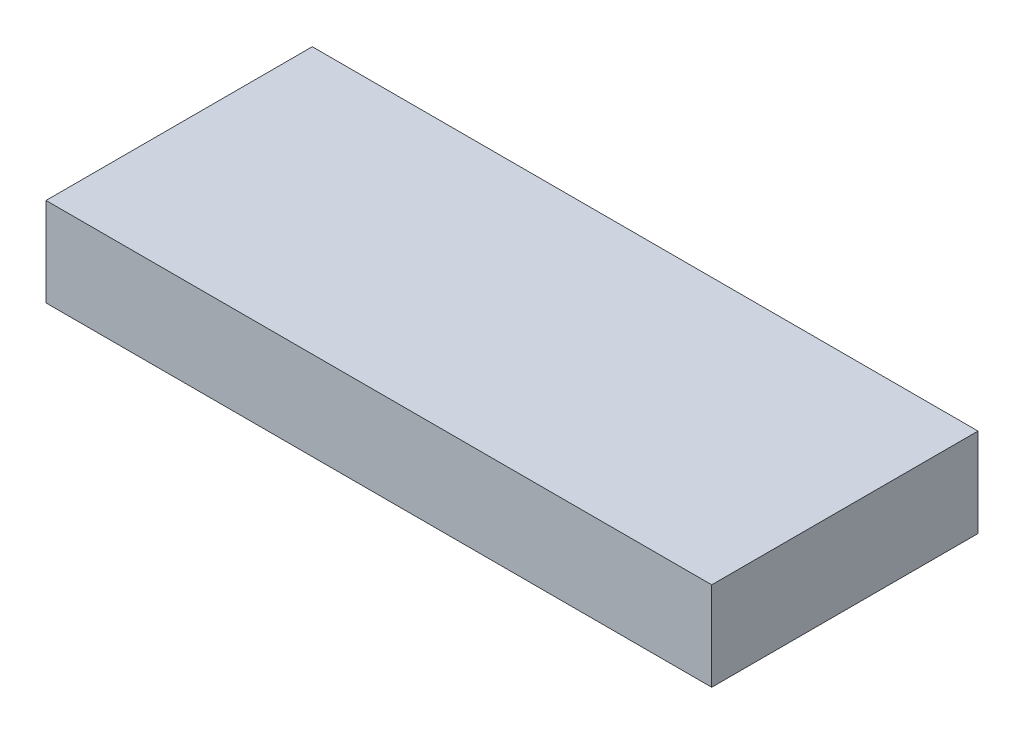
from build123d import *

# Parameters (mm, degrees)
SKETCH1_W      = 60
SKETCH1_H      = 24
EXTRUDE1_DEPTH = 8


with BuildPart() as part:
    # Sketch1 → Extrude1 (new body)
    with BuildSketch(Plane(origin=(0, 0, 0), x_dir=(1, 0, 0), z_dir=(0, 1, 0))):
        with Locations((8.220703684, -3.472673295)):
            Rectangle(SKETCH1_W, SKETCH1_H)
    extrude(amount=EXTRUDE1_DEPTH)


solid = part.part
